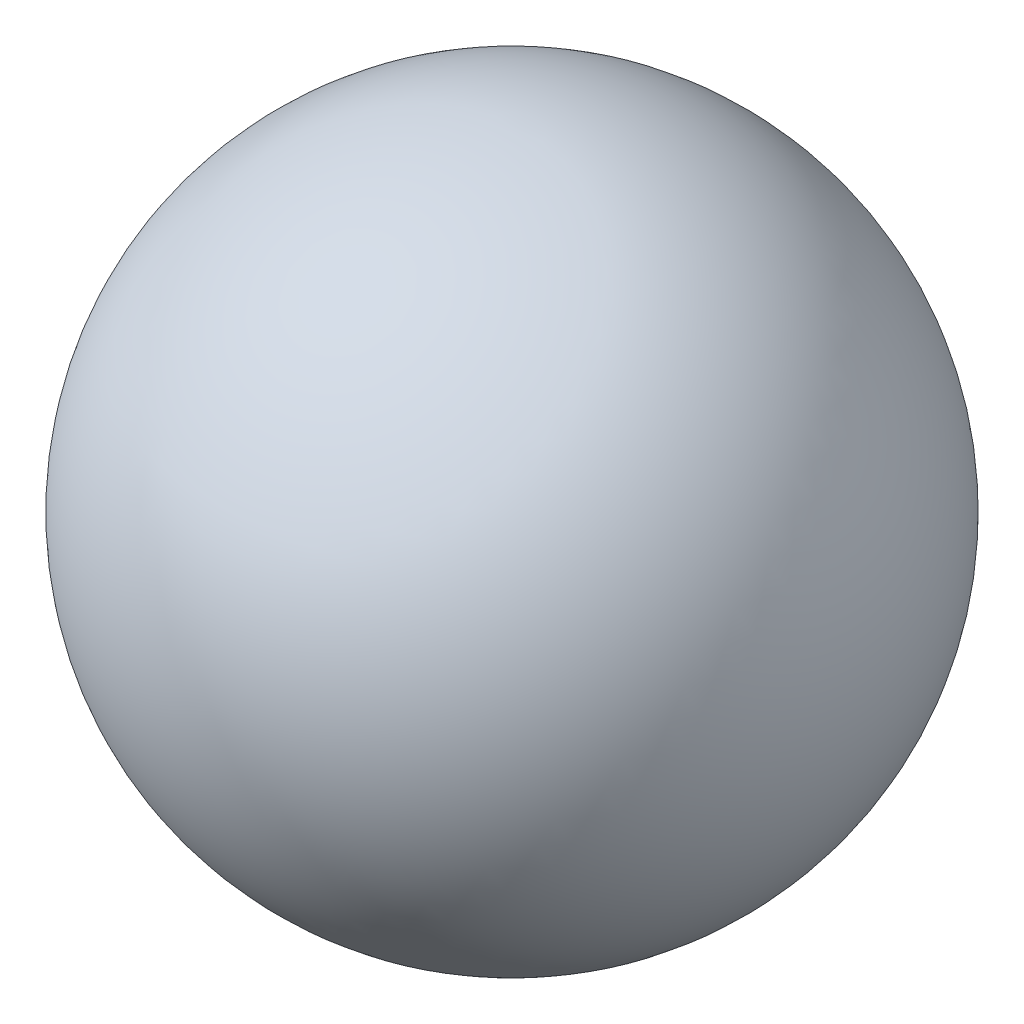
from build123d import *


with BuildPart() as part:
    # 草圖1 → 旋轉1 (revolve)
    with BuildSketch(Plane(origin=(0, 0, 0), x_dir=(0, 0, -1), z_dir=(1, 0, 0))):
        with BuildLine():
            Line((0, 10), (0, 0))
            ThreePointArc((0, 0), (60, -60), (0, -120))
            Line((0, -120), (0, -130))
            ThreePointArc((0, -130), (70, -60), (0, 10))
        make_face()
    revolve(axis=Axis((0, 69.724802602, 0), (0, -1, 0)))


solid = part.part
